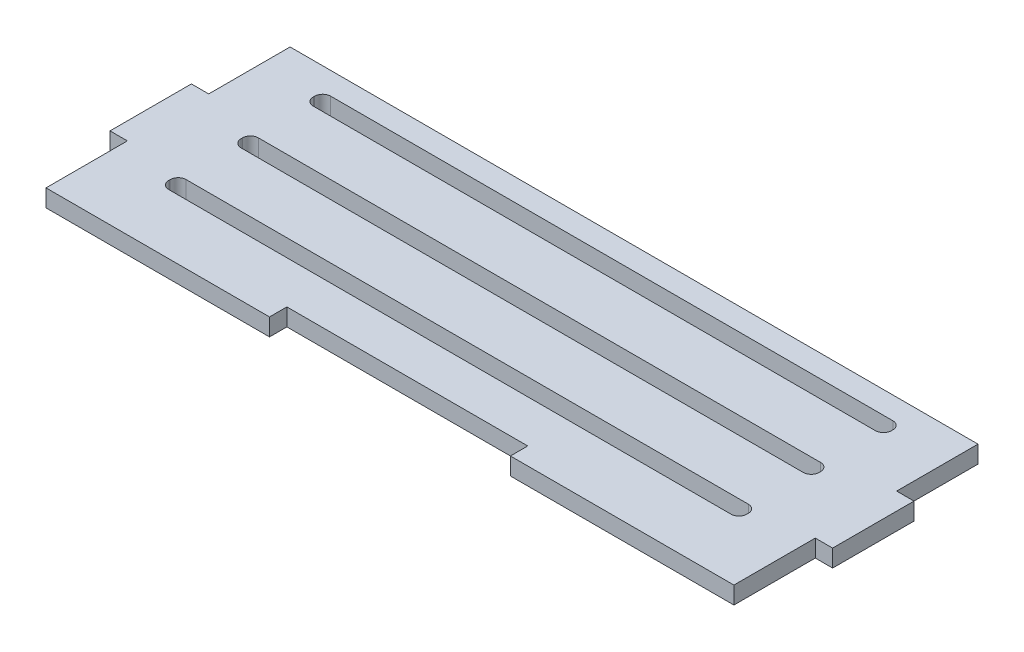
from build123d import *

# Parameters (mm, degrees)
SKETCH1_W           = 500
SKETCH1_H           = 168.89
BOSS_EXTRUDE1_DEPTH = 12
SKETCH2_W           = 166.666666666
SKETCH2_H           = 12
CUT_EXTRUDE1_DEPTH  = 528.889981057
SKETCH4_W           = 12
SKETCH4_H           = 56.296666667
CUT_EXTRUDE3_DEPTH  = 528.889981057
CUT_EXTRUDE4_DEPTH  = 528.889981057
LPATTERN1_COUNT     = 3
LPATTERN1_PITCH     = 50
SCALE1_SCALE        = 0.5


with BuildPart() as part:
    # Sketch1 → Boss-Extrude1 (new body)
    with BuildSketch(Plane(origin=(0, 0, 0), x_dir=(1, 0, 0), z_dir=(0, 1, 0))):
        with Locations((250, 84.445)):
            Rectangle(SKETCH1_W, SKETCH1_H)
    extrude(amount=BOSS_EXTRUDE1_DEPTH)

    # Sketch2 → Cut-Extrude1 (cut, through all)
    with BuildSketch(Plane(origin=(0, 12, 0), x_dir=(1, 0, 0), z_dir=(0, 1, 0))):
        with Locations((250, 6)):
            Rectangle(SKETCH2_W, SKETCH2_H)
    extrude(amount=-CUT_EXTRUDE1_DEPTH, mode=Mode.SUBTRACT)

    # Sketch4 → Cut-Extrude3 (cut, through all)
    with BuildSketch(Plane(origin=(0, 12, 0), x_dir=(1, 0, 0), z_dir=(0, 1, 0))):
        with Locations((6, 140.741666667)):
            Rectangle(SKETCH4_W, SKETCH4_H)
        with Locations((6, 28.148333334)):
            Rectangle(SKETCH4_W, SKETCH4_H)
        with Locations((494, 28.148333334)):
            Rectangle(SKETCH4_W, SKETCH4_H)
        with Locations((494, 140.741666667)):
            Rectangle(SKETCH4_W, SKETCH4_H)
    extrude(amount=-CUT_EXTRUDE3_DEPTH, mode=Mode.SUBTRACT)

    # Sketch5 → Cut-Extrude4 (cut, through all)
    with BuildSketch(Plane(origin=(0, 12, 0), x_dir=(1, 0, 0), z_dir=(0, 1, 0))):
        with BuildLine():
            Line((55.5, 153.449523313), (444.5, 153.449523313))
            ThreePointArc((444.5, 153.449523313), (448.389087297, 151.838610609), (450, 147.949523313))
            Line((450, 147.949523313), (450, 146.949523313))
            ThreePointArc((450, 146.949523313), (448.389087297, 143.060436016), (444.5, 141.449523313))
            Line((444.5, 141.449523313), (55.5, 141.449523313))
            ThreePointArc((55.5, 141.449523313), (51.610912703, 143.060436016), (50, 146.949523313))
            Line((50, 146.949523313), (50, 147.949523313))
            ThreePointArc((50, 147.949523313), (51.610912703, 151.838610609), (55.5, 153.449523313))
        make_face()
    cut_extrude4 = extrude(amount=-CUT_EXTRUDE4_DEPTH, mode=Mode.SUBTRACT)

    # LPattern1: Cut-Extrude4 ×3
    with Locations(*[(0, 0, i * LPATTERN1_PITCH) for i in range(1, LPATTERN1_COUNT)]):
        add(cut_extrude4, mode=Mode.SUBTRACT)


with BuildPart() as part_1:
    # Scale1: scaled about (250, 6, -83.99618036)
    add(part.part.scale(SCALE1_SCALE).moved(Location((125, 3, -41.99809018))))


solid = part_1.part
